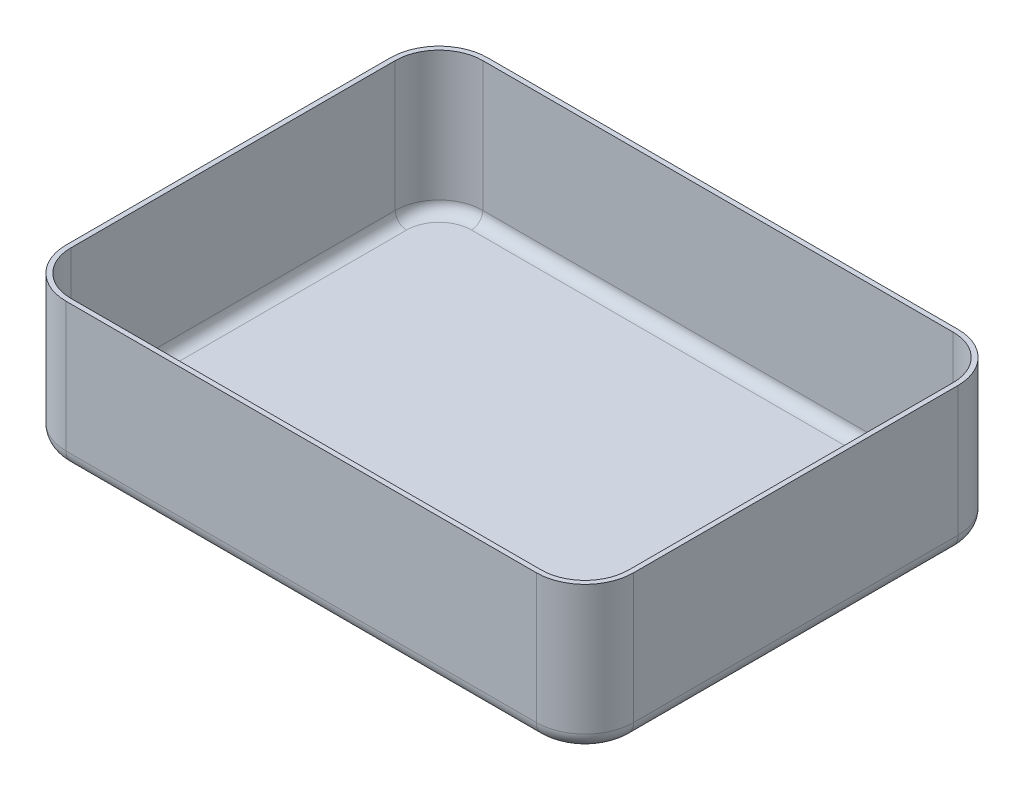
from build123d import *

# Parameters (mm, degrees)
SKETCH_1_W      = 350
SKETCH_1_H      = 260
EXTRUDE_1_DEPTH = 90
FILLET_1_R      = 30
FILLET_2_R      = 10
SHELL_1_T       = -3


with BuildPart() as part:
    # 草圖1 → 填料-伸長1 (new body)
    with BuildSketch(Plane(origin=(0, 0, 0), x_dir=(1, 0, 0), z_dir=(0, 1, 0))):
        Rectangle(SKETCH_1_W, SKETCH_1_H)
    extrude(amount=EXTRUDE_1_DEPTH)

    # 圓角1
    fillet_1_edges = [part.edges().sort_by_distance(p)[0] for p in [
        (175, 45, 130),
        (-175, 45, 130),
        (-175, 45, -130),
        (175, 45, -130),
    ]]
    fillet(fillet_1_edges, radius=FILLET_1_R)

    # 圓角2
    fillet_2_edges = [part.edges().sort_by_distance(p)[0] for p in [
        (-175, 0, 0),
        (175, 0, 0),
        (0, 0, 130),
        (0, 0, -130),
        (166.213203436, 0, 121.213203436),
        (166.213203436, 0, -121.213203436),
        (-166.213203436, 0, 121.213203436),
        (-166.213203436, 0, -121.213203436),
    ]]
    fillet(fillet_2_edges, radius=FILLET_2_R)

    # 薄殼1
    shell_1_openings = [part.faces().sort_by_distance(p)[0] for p in [
        (0, 90, 0),
    ]]
    offset(amount=SHELL_1_T, openings=shell_1_openings, kind=Kind.INTERSECTION)


solid = part.part
